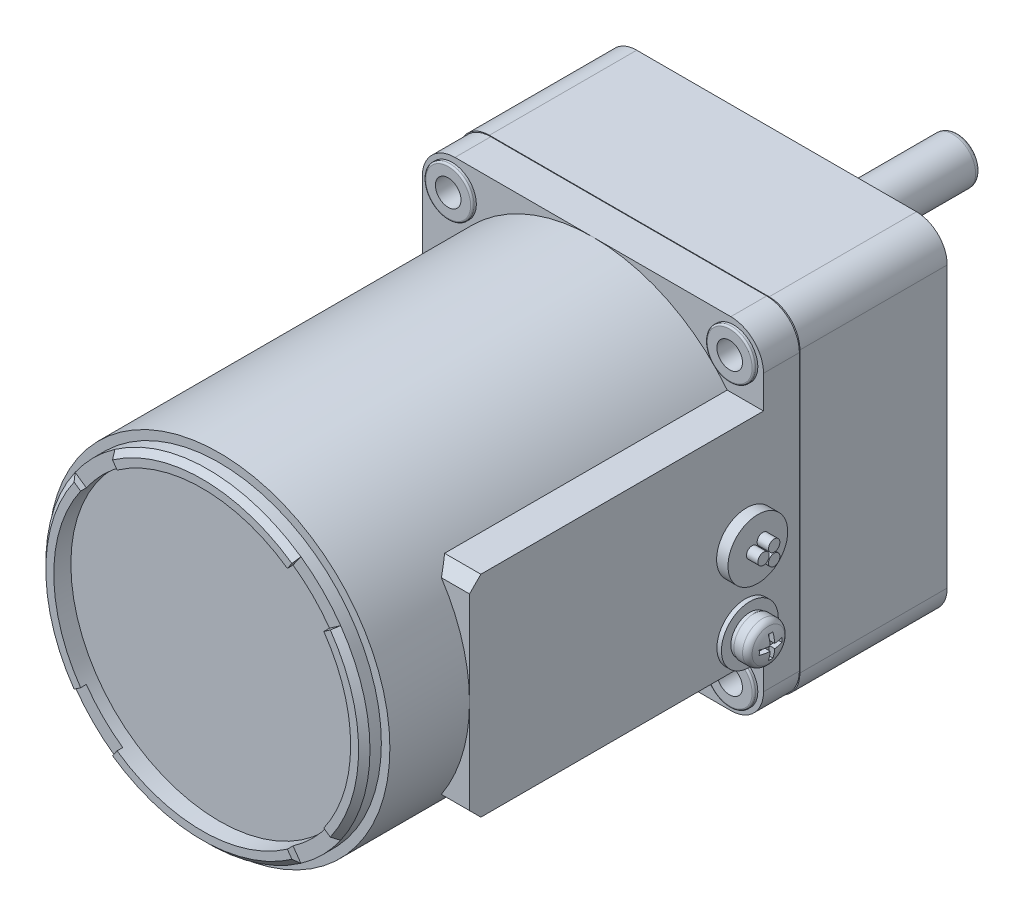
from build123d import *

# Parameters (mm, degrees)
EXTRUDE_1_DEPTH             = 26
EXTRUDE_2_DEPTH             = 6.3
SKETCH_4_W                  = 60
SKETCH_4_H                  = 60
CUT_EXTRUDE_1_DEPTH         = 0.1
CUT_EXTRUDE_2_DEPTH         = 1
EXTRUDE_3_DEPTH             = 30
PATTERN_LINEAR_1_COUNT      = 2
PATTERN_LINEAR_1_PITCH      = 49.497474683
PATTERN_LINEAR_1_COUNT_DIR2 = 2
PATTERN_LINEAR_1_PITCH_DIR2 = 49.497474683
SKETCH_10_W                 = 2
SKETCH_10_H                 = 5.25
SKETCH_11_R                 = 1
EXTRUDE_4_DEPTH             = 2
SKETCH_12_R                 = 1
EXTRUDE_5_DEPTH             = 2
SKETCH_13_R                 = 1
EXTRUDE_6_DEPTH             = 2
CUT_EXTRUDE_3_DEPTH         = 1
SKETCH_16_W                 = 33
SKETCH_16_H                 = 2.25
PATTERN_LINEAR_2_COUNT      = 2
PATTERN_LINEAR_2_PITCH      = 49.497474683
PATTERN_LINEAR_2_COUNT_DIR2 = 2
PATTERN_LINEAR_2_PITCH_DIR2 = 49.497474683


with BuildPart() as part:
    # 草图1 → 凸台-拉伸1 (new body)
    with BuildSketch(Plane.XY):
        with BuildLine():
            Line((-30, 24.6), (-30, -24.6))
            ThreePointArc((-30, -24.6), (-28.418376618, -28.418376618), (-24.6, -30))
            Line((-24.6, -30), (24.6, -30))
            ThreePointArc((24.6, -30), (28.418376618, -28.418376618), (30, -24.6))
            Line((30, -24.6), (30, 24.6))
            ThreePointArc((30, 24.6), (28.418376618, 28.418376618), (24.6, 30))
            Line((24.6, 30), (-24.6, 30))
            ThreePointArc((-24.6, 30), (-28.418376618, 28.418376618), (-30, 24.6))
        make_face()
    extrude(amount=EXTRUDE_1_DEPTH)

    # 草图2 → 旋转1 (revolve)
    with BuildSketch(Plane(origin=(0, 0, 0), x_dir=(0, 0, -1), z_dir=(1, 0, 0))):
        with BuildLine():
            Line((0, 10), (0, 22.5))
            Line((0, 22.5), (5, 22.5))
            ThreePointArc((5, 22.5), (5.707106781, 22.207106781), (6, 21.5))
            Line((6, 21.5), (6, 14))
            Line((6, 14), (31, 14))
            ThreePointArc((31, 14), (31.707106781, 13.707106781), (32, 13))
            Line((32, 13), (32, 10))
            Line((32, 10), (0, 10))
        make_face()
    revolve(axis=Axis((0, 10, -32), (0, 0, 1)))

    # 草图3 → 凸台-拉伸2 (add)
    with BuildSketch(Plane.XY.offset(26)):
        with BuildLine():
            Line((-30, 24.25), (-30, -24.25))
            ThreePointArc((-30, -24.25), (-28.315863992, -28.315863992), (-24.25, -30))
            Line((-24.25, -30), (24.25, -30))
            ThreePointArc((24.25, -30), (28.315863992, -28.315863992), (30, -24.25))
            Line((30, -24.25), (30, 24.25))
            ThreePointArc((30, 24.25), (28.315863992, 28.315863992), (24.25, 30))
            Line((24.25, 30), (-24.25, 30))
            ThreePointArc((-24.25, 30), (-28.315863992, 28.315863992), (-30, 24.25))
        make_face()
    extrude(amount=EXTRUDE_2_DEPTH)

    # 草图4 → 切除-拉伸1 (cut)
    with BuildSketch(Plane.XY.offset(26)):
        Rectangle(SKETCH_4_W, SKETCH_4_H)
        with BuildLine():
            Line((-29, 24.25), (-29, -24.25))
            ThreePointArc((-29, -24.25), (-27.608757211, -27.608757211), (-24.25, -29))
            Line((-24.25, -29), (24.25, -29))
            ThreePointArc((24.25, -29), (27.608757211, -27.608757211), (29, -24.25))
            Line((29, -24.25), (29, 24.25))
            ThreePointArc((29, 24.25), (27.608757211, 27.608757211), (24.25, 29))
            Line((24.25, 29), (-24.25, 29))
            ThreePointArc((-24.25, 29), (-27.608757211, 27.608757211), (-29, 24.25))
        make_face(mode=Mode.SUBTRACT)
    extrude(amount=-CUT_EXTRUDE_1_DEPTH, mode=Mode.SUBTRACT)

    # 草图5 → 旋转2 (revolve)
    with BuildSketch(Plane(origin=(0, 0, 0), x_dir=(0, 0, -1), z_dir=(1, 0, 0))):
        Polygon((-98, 0), (-98, 26.1), (-101, 26.1), (-101, 27.5), (-100, 28.5), (-98, 28.5), (-98, 30), (-32.3, 30), (-32.3, 0), align=None)
    revolve(axis=Axis((0, 0, 32.3), (0, 0, 1)))

    # 草图6 → 切除-拉伸2 (cut)
    with BuildSketch(Plane.XY.offset(101)):
        with BuildLine():
            Line((-21.379868356, -14.970344989), (-23.345833262, -16.346928436))
            ThreePointArc((-23.345833262, -16.346928436), (-20.152543264, -20.152543264), (-16.346928436, -23.345833262))
            Line((-16.346928436, -23.345833262), (-14.970344989, -21.379868356))
            ThreePointArc((-14.970344989, -21.379868356), (0, -26.1), (14.970344989, -21.379868356))
            Line((14.970344989, -21.379868356), (16.346928436, -23.345833262))
            ThreePointArc((16.346928436, -23.345833262), (20.152543264, -20.152543264), (23.345833262, -16.346928436))
            Line((23.345833262, -16.346928436), (21.379868356, -14.970344989))
            ThreePointArc((21.379868356, -14.970344989), (26.1, 0), (21.379868356, 14.970344989))
            Line((21.379868356, 14.970344989), (23.345833262, 16.346928436))
            ThreePointArc((23.345833262, 16.346928436), (20.152543264, 20.152543264), (16.346928436, 23.345833262))
            Line((16.346928436, 23.345833262), (14.970344989, 21.379868356))
            ThreePointArc((14.970344989, 21.379868356), (0, 26.1), (-14.970344989, 21.379868356))
            Line((-14.970344989, 21.379868356), (-16.346928436, 23.345833262))
            ThreePointArc((-16.346928436, 23.345833262), (-20.152543264, 20.152543264), (-23.345833262, 16.346928436))
            Line((-23.345833262, 16.346928436), (-21.379868356, 14.970344989))
            ThreePointArc((-21.379868356, 14.970344989), (-26.1, 0), (-21.379868356, -14.970344989))
        make_face()
    extrude(amount=-CUT_EXTRUDE_2_DEPTH, mode=Mode.SUBTRACT)

    # 草图7 → 凸台-拉伸3 (add)
    with BuildSketch(Plane(origin=(30, 0, 0), x_dir=(0, 0, -1), z_dir=(1, 0, 0))):
        Polygon((-84, -16.5), (-82, -18.5), (-26, -18.5), (-26, 18.5), (-82, 18.5), (-84, 16.5), align=None)
    extrude(amount=-EXTRUDE_3_DEPTH)

    # 草图8 → 旋转3 (revolve)
    with BuildSketch(Plane(origin=(0, 0, 0), x_dir=(0, 0, -1), z_dir=(0.7071067811865476, 0.7071067811865475, 0))):
        with BuildLine():
            Line((-33, -35), (-33, -31.05))
            ThreePointArc((-33, -31.05), (-32.912132034, -30.837867966), (-32.7, -30.75))
            Line((-32.7, -30.75), (-32.3, -30.75))
            Line((-32.3, -30.75), (-32.3, -35))
            Line((-32.3, -35), (-33, -35))
        make_face()
    revolve_3 = revolve(axis=Axis((24.748737342, -24.748737342, 32.3), (0, 0, 1)))

    # 阵列(线性)1: Revolve 3 2 × 2
    with Locations(*[(-j * PATTERN_LINEAR_1_PITCH_DIR2, i * PATTERN_LINEAR_1_PITCH, 0) for i in range(PATTERN_LINEAR_1_COUNT) for j in range(PATTERN_LINEAR_1_COUNT_DIR2) if (i, j) != (0, 0)]):
        add(revolve_3)

    # 草图10 → 旋转4 (revolve)
    with BuildSketch(Plane(origin=(0, 0, 0), x_dir=(1, 0, 0), z_dir=(0, 1, 0))):
        with Locations((31, -37.925)):
            Rectangle(SKETCH_10_W, SKETCH_10_H)
    revolve(axis=Axis((30, 0, 35.3), (1, 0, 0)))

    # 草图11 → 凸台-拉伸4 (add)
    with BuildSketch(Plane(origin=(32, 0, 0), x_dir=(0, 0, -1), z_dir=(1, 0, 0))):
        with Locations((-36.3, 0)):
            Circle(SKETCH_11_R)
    extrude(amount=EXTRUDE_4_DEPTH)

    # 草图12 → 凸台-拉伸5 (add)
    with BuildSketch(Plane(origin=(32, 0, 0), x_dir=(0, 0, -1), z_dir=(1, 0, 0))):
        with Locations((-34.425, -1.082531755)):
            Circle(SKETCH_12_R)
    extrude(amount=EXTRUDE_5_DEPTH)

    # 草图13 → 凸台-拉伸6 (add)
    with BuildSketch(Plane(origin=(32, 0, 0), x_dir=(0, 0, -1), z_dir=(1, 0, 0))):
        with Locations((-34.425, 1.082531755)):
            Circle(SKETCH_13_R)
    extrude(amount=EXTRUDE_6_DEPTH)

    # 草图14 → 旋转5 (revolve)
    with BuildSketch(Plane(origin=(0, -13.5, 0), x_dir=(1, 0, 0), z_dir=(0, 1, 0))):
        with BuildLine():
            Line((33.013074887, -39), (31.5, -39))
            Line((31.5, -39), (31.5, -38.85))
            Line((31.5, -38.85), (30.8, -38.85))
            Line((30.8, -38.85), (30.8, -40.5))
            Line((30.8, -40.5), (30, -40.5))
            Line((30, -40.5), (30, -35.5))
            Line((30, -35.5), (34.8, -35.5))
            ThreePointArc((34.8, -35.5), (34.613693389, -36.98356637), (34.066343608, -38.375))
            ThreePointArc((34.066343608, -38.375), (33.625447322, -38.831988372), (33.013074887, -39))
        make_face()
    revolve(axis=Axis((30, -13.5, 35.5), (1, 0, 0)))

    # 草图15 → 切除-拉伸3 (cut)
    with BuildSketch(Plane(origin=(34.8, 0, 0), x_dir=(0, 0, -1), z_dir=(1, 0, 0))):
        Polygon((-37.5, -13.1), (-37.5, -13.9), (-35.9, -13.9), (-35.9, -15.5), (-35.1, -15.5), (-35.1, -13.9), (-33.5, -13.9), (-33.5, -13.1), (-35.1, -13.1), (-35.1, -11.5), (-35.9, -11.5), (-35.9, -13.1), align=None)
    extrude(amount=-CUT_EXTRUDE_3_DEPTH, mode=Mode.SUBTRACT)

    # 草图16 → 切除-旋转1 (revolve, cut)
    with BuildSketch(Plane(origin=(0, 0, 0), x_dir=(0, 0, -1), z_dir=(0.7071067811865476, 0.7071067811865475, 0))):
        with Locations((-16.5, -33.875)):
            Rectangle(SKETCH_16_W, SKETCH_16_H)
    cut_revolve_1 = revolve(axis=Axis((24.748737342, -24.748737342, 0), (0, 0, 1)), mode=Mode.SUBTRACT)

    # 阵列(线性)2: Cut-Revolve 1 2 × 2
    with Locations(*[(-j * PATTERN_LINEAR_2_PITCH_DIR2, i * PATTERN_LINEAR_2_PITCH, 0) for i in range(PATTERN_LINEAR_2_COUNT) for j in range(PATTERN_LINEAR_2_COUNT_DIR2) if (i, j) != (0, 0)]):
        add(cut_revolve_1, mode=Mode.SUBTRACT)


solid = part.part
